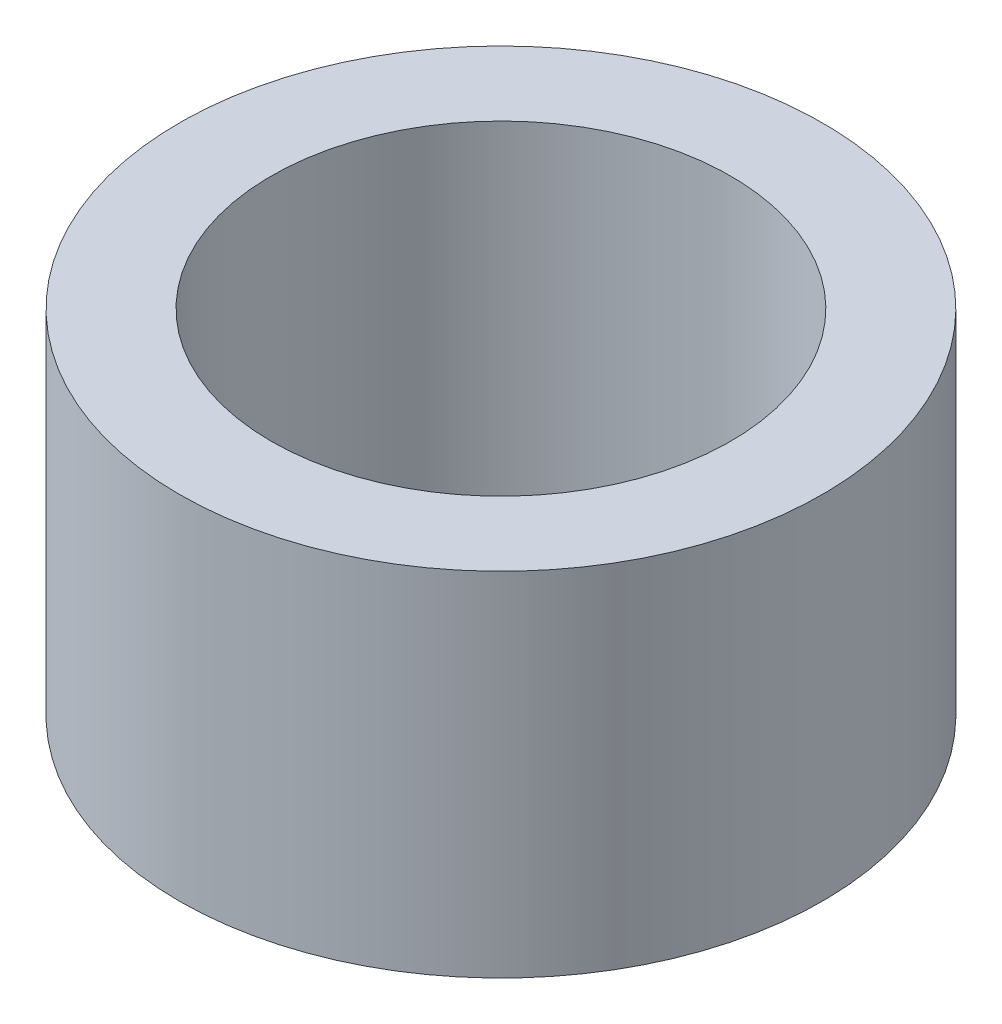
from build123d import *

# Parameters (mm, degrees)
SKETCH_1_R      = 4.2
SKETCH_1_R_2    = 3
EXTRUDE_1_DEPTH = 4.6


with BuildPart() as part:
    # ｽｹｯﾁ1 → ﾎﾞｽ - 押し出し1 (new body)
    with BuildSketch(Plane(origin=(0, 0, 0), x_dir=(1, 0, 0), z_dir=(0, 1, 0))):
        with Locations(Location((0, 0, 0), (0, 0, 270))):
            Circle(SKETCH_1_R)
        with Locations(Location((0, 0, 0), (0, 0, 270))):
            Circle(SKETCH_1_R_2, mode=Mode.SUBTRACT)
    extrude(amount=EXTRUDE_1_DEPTH)


solid = part.part
